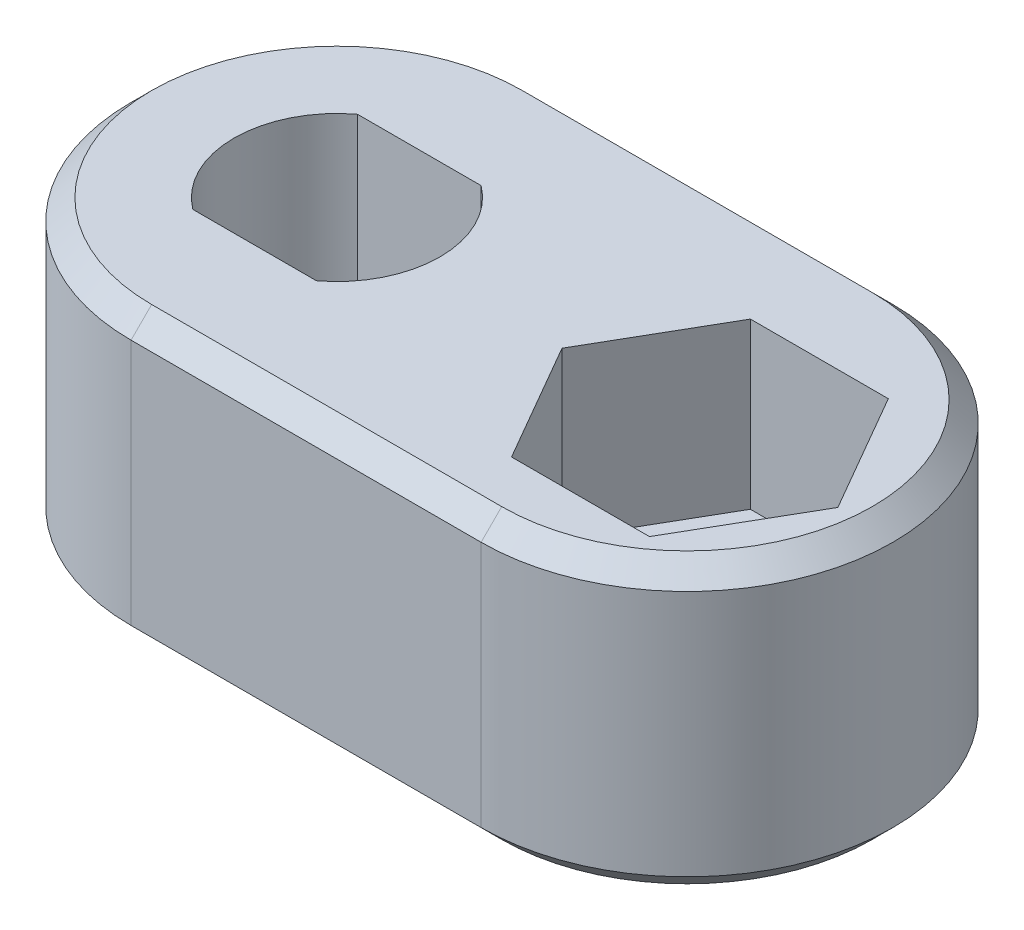
from build123d import *

# Parameters (mm, degrees)
EXTRUDE_1_DEPTH              = 7
CUT_EXTRUDE_1_DEPTH          = 4
HOLE_WIZARD_M3_1_D           = 3.4
HOLE_WIZARD_M3_1_DEPTH       = 7.5
HOLE_WIZARD_M3_1_CSINK_D     = 6.72
HOLE_WIZARD_M3_1_CSINK_ANGLE = 90
HOLE_WIZARD_M3_1_TIP         = 1.021463052
HOLE_WIZARD_1_D              = 4.15
CUT_EXTRUDE_2_DEPTH          = 4
CHAMFER_1_SIZE               = 0.5


with BuildPart() as part:
    # 草图1 → 凸台-拉伸1 (new body)
    with BuildSketch(Plane(origin=(0, 0, 0), x_dir=(1, 0, 0), z_dir=(0, 1, 0))):
        with BuildLine():
            Line((-4.25, 5), (4.25, 5))
            ThreePointArc((4.25, 5), (9.25, 0), (4.25, -5))
            Line((4.25, -5), (-4.25, -5))
            ThreePointArc((-4.25, -5), (-9.25, 0), (-4.25, 5))
        make_face()
    extrude(amount=EXTRUDE_1_DEPTH)

    # 草图2 → 切除-拉伸1 (cut)
    with BuildSketch(Plane(origin=(0, 7, 0), x_dir=(1, 0, 0), z_dir=(0, 1, 0))):
        with BuildLine():
            Line((-2.75, 2), (-5.75, 2))
            ThreePointArc((-5.75, 2), (-6.75, 0), (-5.75, -2))
            Line((-5.75, -2), (-2.75, -2))
            ThreePointArc((-2.75, -2), (-2.013932023, -1.118033989), (-1.75, 0))
            ThreePointArc((-1.75, 0), (-2.013932023, 1.118033989), (-2.75, 2))
        make_face()
    extrude(amount=-CUT_EXTRUDE_1_DEPTH, mode=Mode.SUBTRACT)

    # M3 六角凹锥坑螺钉的锥形沉头孔1
    with Locations(Plane(origin=(0, 0, 0), x_dir=(-1, 0, 0), z_dir=(0, -1, 0))):
        with Locations((4.25, 0)):
            CounterSinkHole(HOLE_WIZARD_M3_1_D / 2, HOLE_WIZARD_M3_1_CSINK_D / 2, depth=HOLE_WIZARD_M3_1_DEPTH, counter_sink_angle=HOLE_WIZARD_M3_1_CSINK_ANGLE)
            with Locations((0, 0, -(HOLE_WIZARD_M3_1_DEPTH + HOLE_WIZARD_M3_1_TIP / 2))):  # 118° drill point
                Cone(0, HOLE_WIZARD_M3_1_D / 2, HOLE_WIZARD_M3_1_TIP, mode=Mode.SUBTRACT)

    # 孔1 (through all)
    with Locations(Plane(origin=(0, 7, 0), x_dir=(1, 0, 0), z_dir=(0, 1, 0))):
        with Locations((5, -0.436816998)):
            Hole(HOLE_WIZARD_1_D / 2)

    # 草图12 → 切除-拉伸2 (cut)
    with BuildSketch(Plane(origin=(0, 7, 0), x_dir=(1, 0, 0), z_dir=(0, 1, 0))):
        Polygon((8.348631561, -0.436816998), (6.674315781, 2.463183002), (3.325684219, 2.463183002), (1.651368439, -0.436816998), (3.325684219, -3.336816998), (6.674315781, -3.336816998), align=None)
    extrude(amount=-CUT_EXTRUDE_2_DEPTH, mode=Mode.SUBTRACT)

    # 倒角1
    chamfer_1_edges = [part.edges().sort_by_distance(p)[0] for p in [
        (9.25, 7, 0),
        (0, 7, -5),
        (-9.25, 7, 0),
        (0, 0, -5),
        (9.25, 0, 0),
        (0, 0, 5),
        (-9.25, 0, 0),
        (0, 7, 5),
    ]]
    chamfer(chamfer_1_edges, length=CHAMFER_1_SIZE)


solid = part.part
